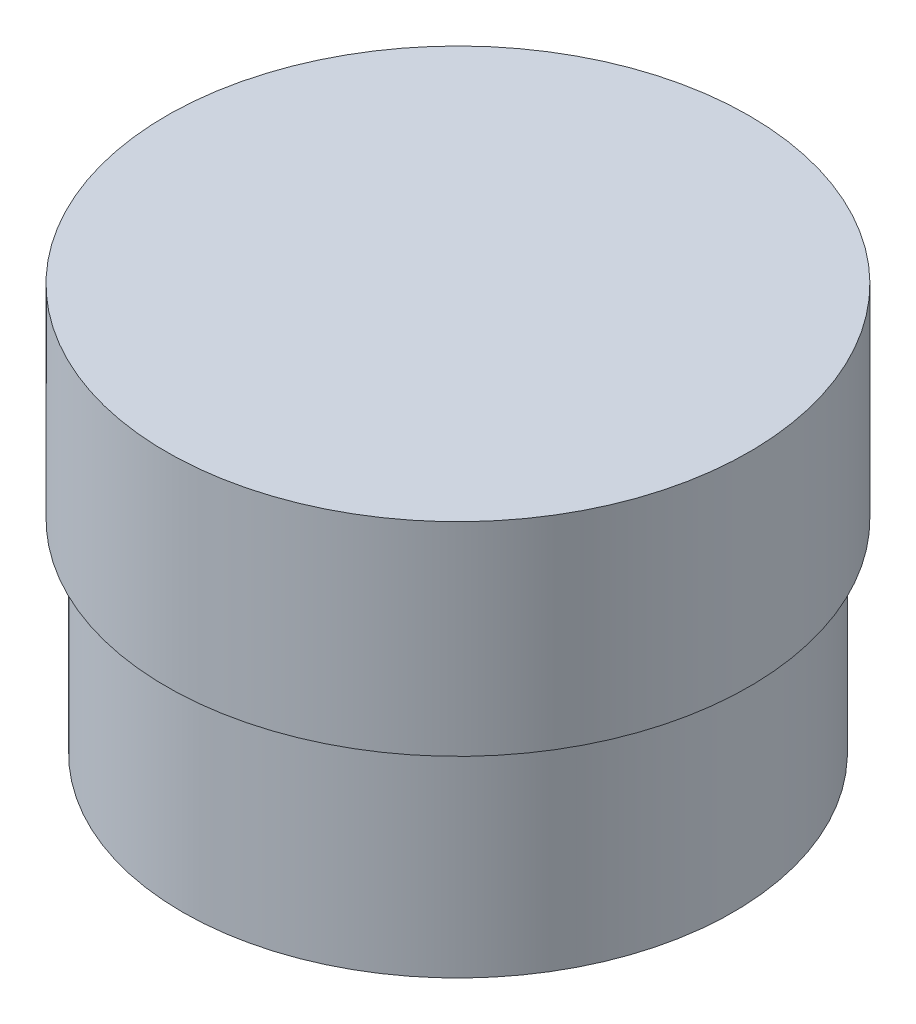
from build123d import *

# Parameters (mm, degrees)
SKETCH1_R           = 30.1
BOSS_EXTRUDE1_DEPTH = 21
SKETCH1_3_R         = 28.45
BOSS_EXTRUDE2_DEPTH = 21
SHELL1_T            = -1


with BuildPart() as part:
    # Sketch1 → Boss-Extrude1 (new body)
    with BuildSketch(Plane(origin=(0, 0, 0), x_dir=(1, 0, 0), z_dir=(0, 1, 0))):
        Circle(SKETCH1_R)
    extrude(amount=BOSS_EXTRUDE1_DEPTH)

    # Sketch1<3> → Boss-Extrude2 (add)
    with BuildSketch(Plane(origin=(0, 0, 0), x_dir=(1, 0, 0), z_dir=(0, 1, 0))):
        Circle(SKETCH1_3_R)
    extrude(amount=-BOSS_EXTRUDE2_DEPTH)

    # Shell1
    shell1_openings = [part.faces().sort_by_distance(p)[0] for p in [
        (0, -21, 0),
    ]]
    offset(amount=SHELL1_T, openings=shell1_openings, kind=Kind.INTERSECTION)


solid = part.part
